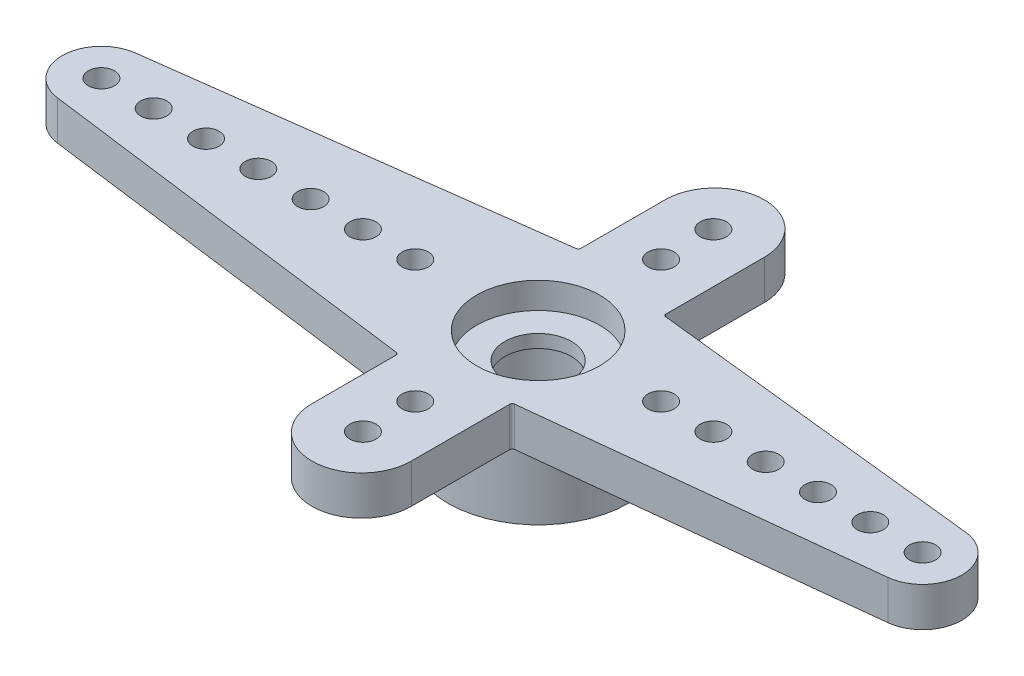
from build123d import *

# Parameters (mm, degrees)
IZIM1_R                     = 0.5
IZIM1_R_2                   = 2.35
Y_KSEKLIK_EKSTR_ZYON1_DEPTH = 1.5
IZIM1_3_R                   = 2.35
IZIM1_3_R_2                 = 1.275
Y_KSEKLIK_EKSTR_ZYON2_DEPTH = 0.5
IZIM2_R                     = 3.45
IZIM2_R_2                   = 2.3
Y_KSEKLIK_EKSTR_ZYON3_DEPTH = 2.5
RADYUS1_R                   = 0.1


with BuildPart() as part:
    # Çizim1 → Yükseklik-Ekstrüzyon1 (new body)
    with BuildSketch(Plane(origin=(0, 0, 0), x_dir=(1, 0, 0), z_dir=(0, 1, 0))):
        with BuildLine():
            ThreePointArc((1.9, 6.75), (0, 8.65), (-1.9, 6.75))
            Line((-1.9, 6.75), (-1.9, 3.45))
            Line((-1.9, 3.45), (-16.894677741, 1.487313207))
            ThreePointArc((-16.894677741, 1.487313207), (-18.2, 0), (-16.894677741, -1.487313207))
            Line((-16.894677741, -1.487313207), (-1.9, -3.45))
            Line((-1.9, -3.45), (-1.9, -6.75))
            ThreePointArc((-1.9, -6.75), (0, -8.65), (1.9, -6.75))
            Line((1.9, -6.75), (1.9, -2.9))
            Line((1.9, -2.9), (14.862072923, -1.491218417))
            ThreePointArc((14.862072923, -1.491218417), (16.2, 0), (14.862072923, 1.491218417))
            Line((14.862072923, 1.491218417), (1.9, 2.9))
            Line((1.9, 2.9), (1.9, 6.75))
        make_face()
        with Locations((0, -6.7)):
            Circle(IZIM1_R, mode=Mode.SUBTRACT)
        with Locations((0, -4.7)):
            Circle(IZIM1_R, mode=Mode.SUBTRACT)
        with Locations((4.7, 0)):
            Circle(IZIM1_R, mode=Mode.SUBTRACT)
        with Locations((6.7, 0)):
            Circle(IZIM1_R, mode=Mode.SUBTRACT)
        with Locations((8.7, 0)):
            Circle(IZIM1_R, mode=Mode.SUBTRACT)
        with Locations((10.7, 0)):
            Circle(IZIM1_R, mode=Mode.SUBTRACT)
        with Locations((12.7, 0)):
            Circle(IZIM1_R, mode=Mode.SUBTRACT)
        with Locations((-16.7, 0)):
            Circle(IZIM1_R, mode=Mode.SUBTRACT)
        with Locations((-14.7, 0)):
            Circle(IZIM1_R, mode=Mode.SUBTRACT)
        with Locations((-12.7, 0)):
            Circle(IZIM1_R, mode=Mode.SUBTRACT)
        with Locations((-10.7, 0)):
            Circle(IZIM1_R, mode=Mode.SUBTRACT)
        with Locations((-8.7, 0)):
            Circle(IZIM1_R, mode=Mode.SUBTRACT)
        with Locations((-6.7, 0)):
            Circle(IZIM1_R, mode=Mode.SUBTRACT)
        with Locations((-4.7, 0)):
            Circle(IZIM1_R, mode=Mode.SUBTRACT)
        Circle(IZIM1_R_2, mode=Mode.SUBTRACT)
        with Locations((14.7, 0)):
            Circle(IZIM1_R, mode=Mode.SUBTRACT)
        with Locations((0, 4.7)):
            Circle(IZIM1_R, mode=Mode.SUBTRACT)
        with Locations((0, 6.7)):
            Circle(IZIM1_R, mode=Mode.SUBTRACT)
    extrude(amount=Y_KSEKLIK_EKSTR_ZYON1_DEPTH)

    # Çizim1<3> → Yükseklik-Ekstrüzyon2 (add)
    with BuildSketch(Plane(origin=(0, 0, 0), x_dir=(1, 0, 0), z_dir=(0, 1, 0))):
        Circle(IZIM1_3_R)
        Circle(IZIM1_3_R_2, mode=Mode.SUBTRACT)
    extrude(amount=Y_KSEKLIK_EKSTR_ZYON2_DEPTH)

    # Çizim2 → Yükseklik-Ekstrüzyon3 (add)
    with BuildSketch(Plane.XZ):
        Circle(IZIM2_R)
        Circle(IZIM2_R_2, mode=Mode.SUBTRACT)
    extrude(amount=Y_KSEKLIK_EKSTR_ZYON3_DEPTH)

    # Radyus1
    radyus1_edges = [part.edges().sort_by_distance(p)[0] for p in [
        (-1.9, 0.75, -3.45),
        (1.9, 0.75, -2.9),
        (1.9, 0.75, 2.9),
        (-1.9, 0.75, 3.45),
    ]]
    fillet(radyus1_edges, radius=RADYUS1_R)


solid = part.part
